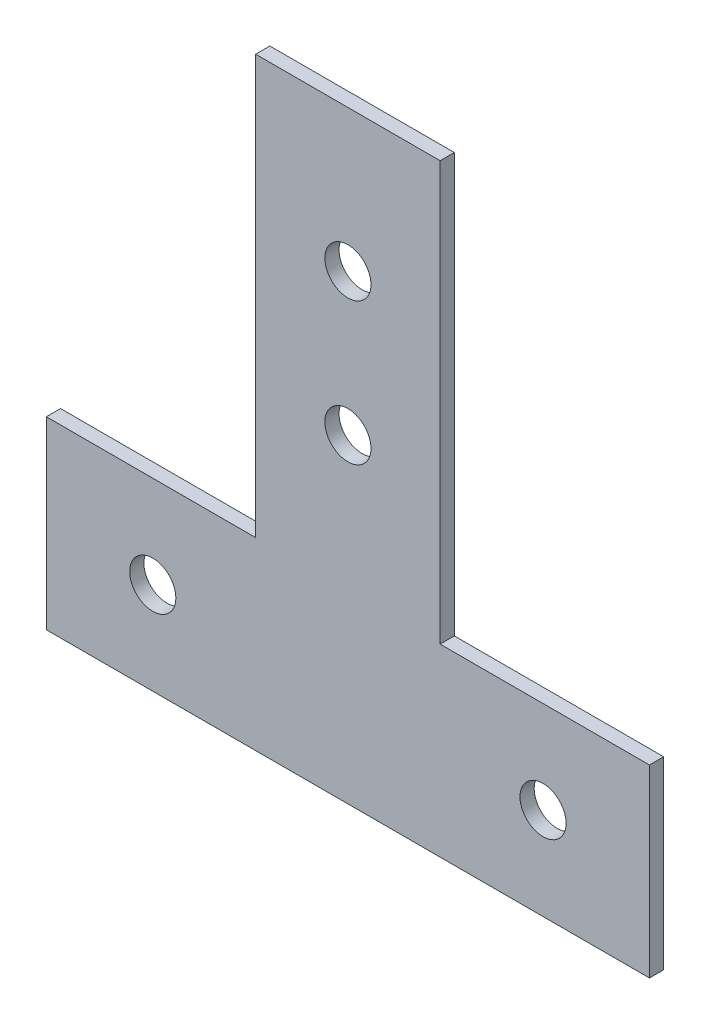
from build123d import *

# Parameters (mm, degrees)
EXTRUDE_1_DEPTH     = 2
SKETCH_2_R          = 3.25
CUT_EXTRUDE_1_DEPTH = 84.631632771


with BuildPart() as part:
    # 草图1 → 凸台-拉伸1 (new body)
    with BuildSketch(Plane.XY):
        Polygon((-42.5, -13), (42.5, -13), (42.5, 13), (13, 13), (13, 72), (-13, 72), (-13, 13), (-42.5, 13), align=None)
    extrude(amount=EXTRUDE_1_DEPTH)

    # 草图2 → 切除-拉伸1 (cut, through all)
    with BuildSketch(Plane.XY.offset(2)):
        with Locations((0, 52)):
            Circle(SKETCH_2_R)
        with Locations((0, 32)):
            Circle(SKETCH_2_R)
        with Locations((-27.5, 0)):
            Circle(SKETCH_2_R)
        with Locations(Location((27.5, 0, 0), (0, 0, 180))):
            Circle(SKETCH_2_R)
    extrude(amount=-CUT_EXTRUDE_1_DEPTH, mode=Mode.SUBTRACT)


solid = part.part
